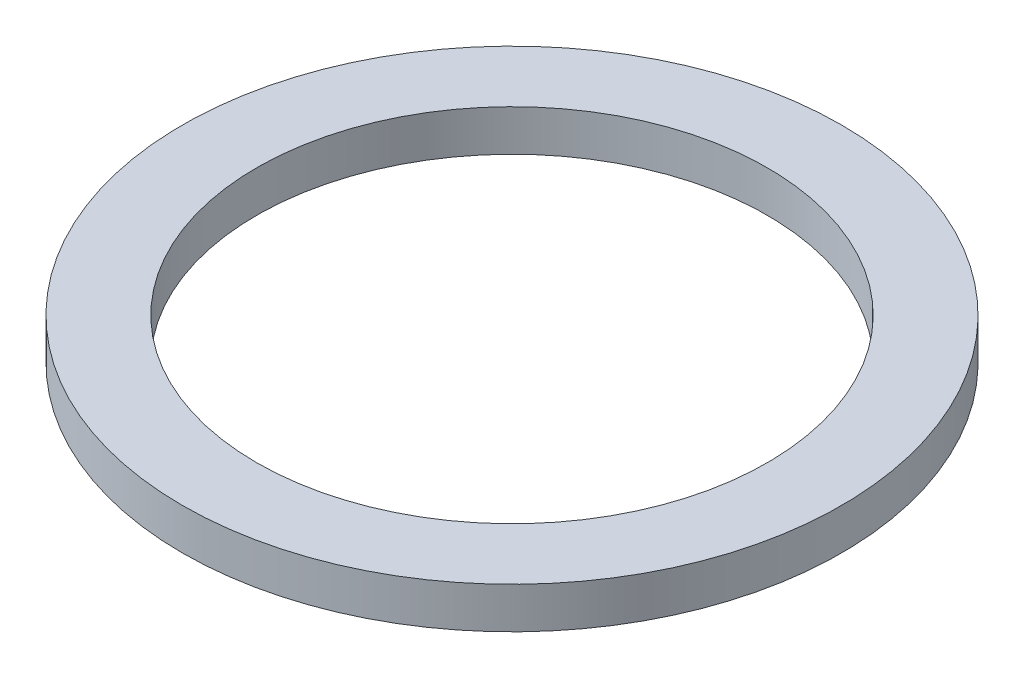
from build123d import *

# Parameters (mm, degrees)
SKETCH1_R           = 50.8
SKETCH1_R_2         = 39.37
BOSS_EXTRUDE1_DEPTH = 6.35


with BuildPart() as part:
    # Sketch1 → Boss-Extrude1 (new body)
    with BuildSketch(Plane(origin=(0, 0, 0), x_dir=(1, 0, 0), z_dir=(0, 1, 0))):
        with Locations(Location((0, 0, 0), (0, 0, 270))):
            Circle(SKETCH1_R)
        with Locations(Location((0, 0, 0), (0, 0, 270))):
            Circle(SKETCH1_R_2, mode=Mode.SUBTRACT)
    extrude(amount=BOSS_EXTRUDE1_DEPTH)


solid = part.part
